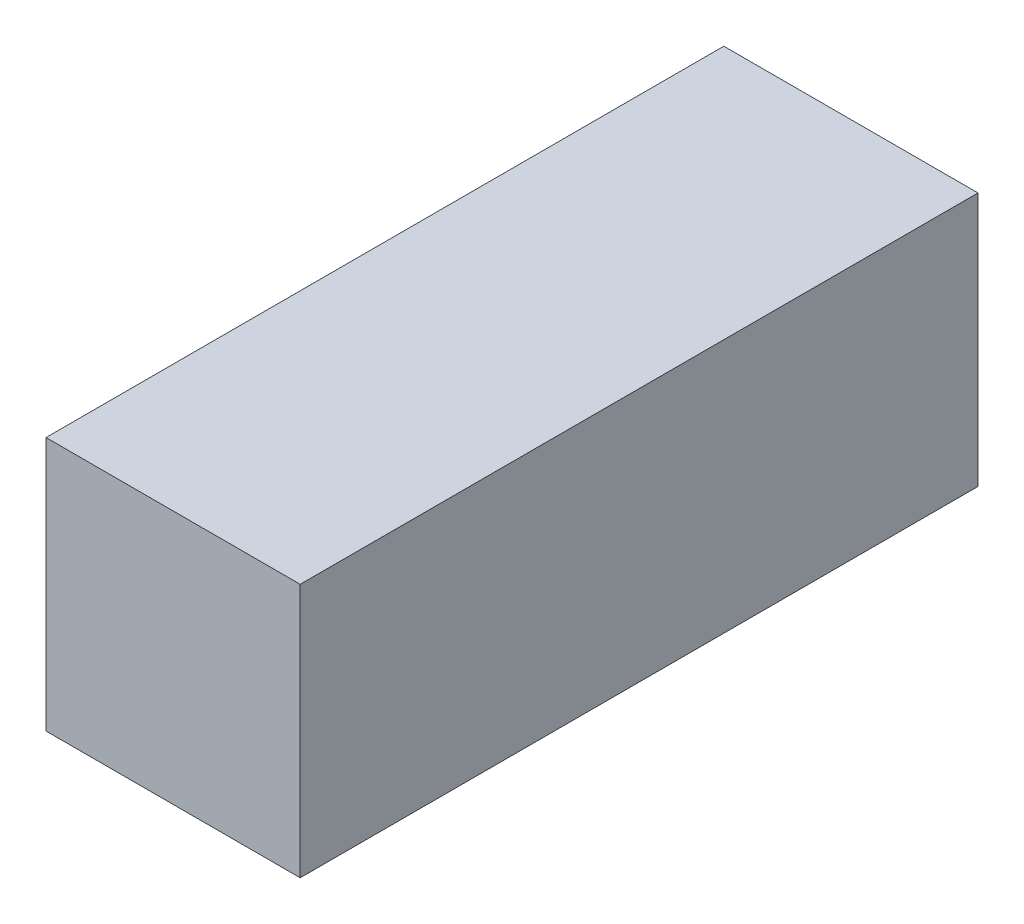
from build123d import *

# Parameters (mm, degrees)
SKETCH1_W           = 3
SKETCH1_H           = 3
BOSS_EXTRUDE1_DEPTH = 8


with BuildPart() as part:
    # Sketch1 → Boss-Extrude1 (new body)
    with BuildSketch(Plane.XY):
        Rectangle(SKETCH1_W, SKETCH1_H)
    extrude(amount=BOSS_EXTRUDE1_DEPTH)


solid = part.part
